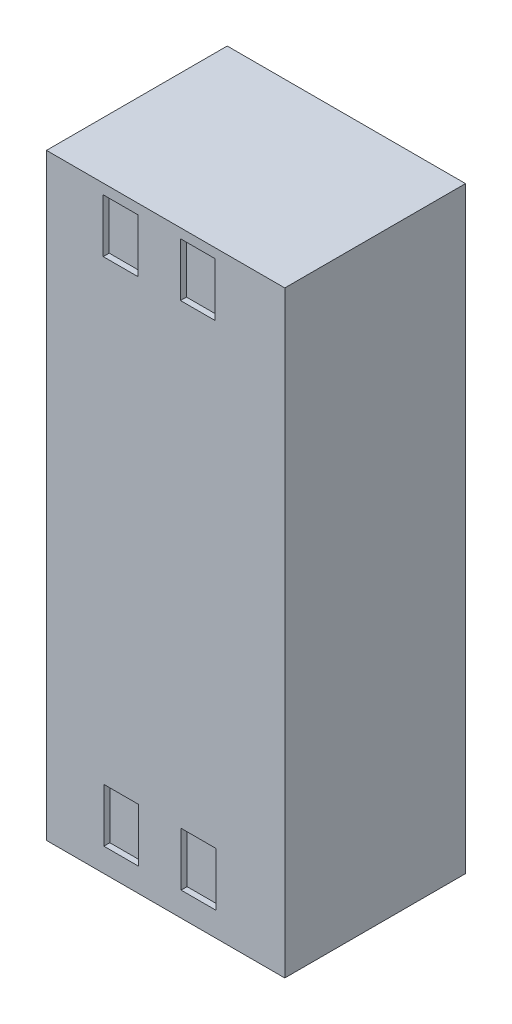
from build123d import *

# Parameters (mm, degrees)
SKETCH1_W           = 50.565864073
SKETCH1_H           = 126.812282012
BOSS_EXTRUDE2_DEPTH = 38.354
SHELL1_T            = 2.54
SKETCH5_W           = 7.375102077
SKETCH5_H           = 11.361908509
SKETCH5_W_2         = 7.375102076
CUT_EXTRUDE3_DEPTH  = 1.27
SKETCH8_W           = 35.70829539
SKETCH8_H           = 19.028689215
CUT_EXTRUDE4_DEPTH  = 1.27


with BuildPart() as part:
    # Sketch1 → Boss-Extrude2 (new body)
    with BuildSketch(Plane.XY):
        with Locations((25.282932037, -63.406141006)):
            Rectangle(SKETCH1_W, SKETCH1_H)
    extrude(amount=BOSS_EXTRUDE2_DEPTH)

    # Shell1 (no face opened: a closed hollow body)
    add(offset(amount=-SHELL1_T, mode=Mode.PRIVATE), mode=Mode.SUBTRACT)

    # Sketch5 → Cut-Extrude3 (cut)
    with BuildSketch(Plane.XY.offset(38.354)):
        with Locations((32.253317714, -115.98095696)):
            Rectangle(SKETCH5_W, SKETCH5_H)
        with Locations((15.859200433, -116.102649257)):
            Rectangle(SKETCH5_W_2, SKETCH5_H)
        with Locations((32.124042774, -7.70128789)):
            Rectangle(SKETCH5_W, SKETCH5_H)
        with Locations((15.729925493, -7.822980187)):
            Rectangle(SKETCH5_W_2, SKETCH5_H)
    extrude(amount=-CUT_EXTRUDE3_DEPTH, mode=Mode.SUBTRACT)

    # Sketch8 → Cut-Extrude4 (cut)
    with BuildSketch(Plane(origin=(0, 0, 0), x_dir=(-1, 0, 0), z_dir=(0, 0, -1))):
        with Locations((-25.453839923, -109.412856846)):
            Rectangle(SKETCH8_W, SKETCH8_H)
    extrude(amount=-CUT_EXTRUDE4_DEPTH, mode=Mode.SUBTRACT)


solid = part.part
